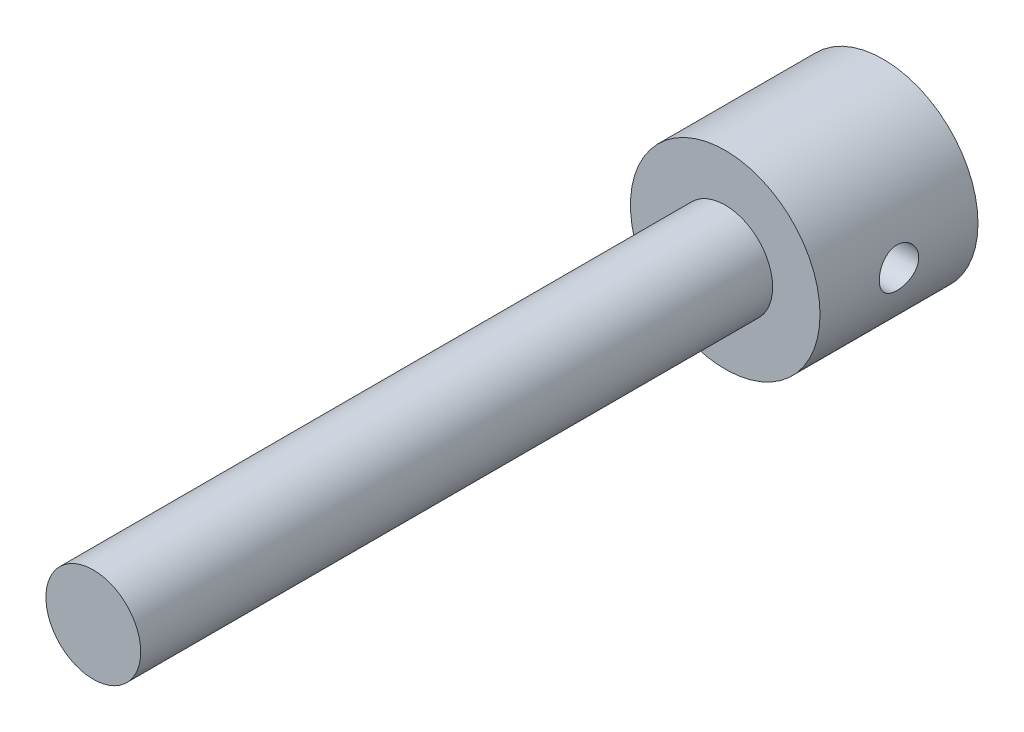
from build123d import *

# Parameters (mm, degrees)
IZIM1_R                     = 12
Y_KSEKLIK_EKSTR_ZYON1_DEPTH = 20
IZIM2_R                     = 6
Y_KSEKLIK_EKSTR_ZYON2_DEPTH = 80
IZIM3_R                     = 2.5
KES_EKSTR_ZYON1_DEPTH       = 40


with BuildPart() as part:
    # Çizim1 → Yükseklik-Ekstrüzyon1 (new body)
    with BuildSketch(Plane.XY):
        Circle(IZIM1_R)
    extrude(amount=Y_KSEKLIK_EKSTR_ZYON1_DEPTH)

    # Çizim2 → Yükseklik-Ekstrüzyon2 (add)
    with BuildSketch(Plane.XY.offset(20)):
        Circle(IZIM2_R)
    extrude(amount=Y_KSEKLIK_EKSTR_ZYON2_DEPTH)

    # Çizim3 → Kes-Ekstrüzyon1 (cut, symmetric)
    with BuildSketch(Plane(origin=(0, 0, 0), x_dir=(0, 0, -1), z_dir=(1, 0, 0))):
        with Locations(Location((-10, 0, 0), (0, 0, 180))):
            Circle(IZIM3_R)
    extrude(amount=KES_EKSTR_ZYON1_DEPTH, both=True, mode=Mode.SUBTRACT)


solid = part.part
